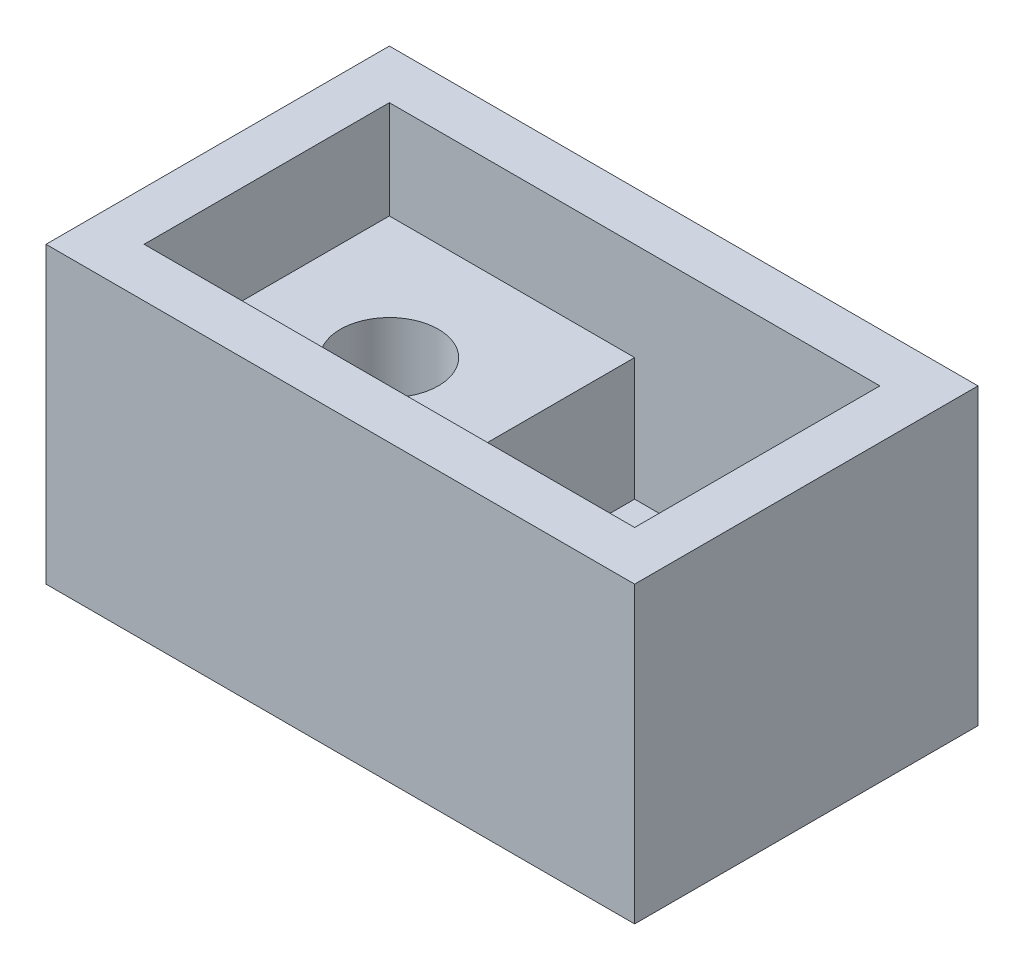
from build123d import *

# Parameters (mm, degrees)
SKETCH1_W           = 304.8
SKETCH1_H           = 177.8
SKETCH1_W_2         = 254
SKETCH1_H_2         = 127
BOSS_EXTRUDE2_DEPTH = 152.4
SKETCH4_W           = 127
SKETCH4_H           = 127
SKETCH4_R           = 25.4
BOSS_EXTRUDE3_DEPTH = 152.4
SKETCH5_W           = 127
SKETCH5_H           = 127
CUT_EXTRUDE1_DEPTH  = 50.8
SKETCH10_W          = 127
SKETCH10_H          = 127
CUT_EXTRUDE2_DEPTH  = 114.3


with BuildPart() as part:
    # Sketch1 → Boss-Extrude2 (new body)
    with BuildSketch(Plane(origin=(0, 0, 0), x_dir=(1, 0, 0), z_dir=(0, 1, 0))):
        with Locations((152.4, 88.9)):
            Rectangle(SKETCH1_W, SKETCH1_H)
        with Locations((152.4, 88.9)):
            Rectangle(SKETCH1_W_2, SKETCH1_H_2, mode=Mode.SUBTRACT)
    extrude(amount=-BOSS_EXTRUDE2_DEPTH)

    # Sketch4 → Boss-Extrude3 (add)
    # profile 1 of 2: a face of its own
    with BuildSketch(Plane(origin=(0, 0, 0), x_dir=(1, 0, 0), z_dir=(0, 1, 0))):
        with Locations((215.9, 88.9)):
            Rectangle(SKETCH4_W, SKETCH4_H)
        with Locations(Location((215.9, 88.9, 0), (0, 0, 270))):
            Circle(SKETCH4_R, mode=Mode.SUBTRACT)
    # profile 2 of 2: a face of its own
    with BuildSketch(Plane(origin=(0, 0, 0), x_dir=(1, 0, 0), z_dir=(0, 1, 0))):
        with Locations((88.9, 88.9)):
            Rectangle(SKETCH4_W, SKETCH4_H)
        with Locations(Location((88.9, 88.9, 0), (0, 0, 270))):
            Circle(SKETCH4_R, mode=Mode.SUBTRACT)
    extrude(amount=-BOSS_EXTRUDE3_DEPTH)

    # Sketch5 → Cut-Extrude1 (cut)
    with BuildSketch(Plane(origin=(0, 0, 0), x_dir=(1, 0, 0), z_dir=(0, 1, 0))):
        with Locations((88.9, 88.9)):
            Rectangle(SKETCH5_W, SKETCH5_H)
    extrude(amount=-CUT_EXTRUDE1_DEPTH, mode=Mode.SUBTRACT)

    # Sketch10 → Cut-Extrude2 (cut)
    with BuildSketch(Plane(origin=(0, 0, 0), x_dir=(1, 0, 0), z_dir=(0, 1, 0))):
        with Locations((215.9, 88.9)):
            Rectangle(SKETCH10_W, SKETCH10_H)
    extrude(amount=-CUT_EXTRUDE2_DEPTH, mode=Mode.SUBTRACT)


solid = part.part
